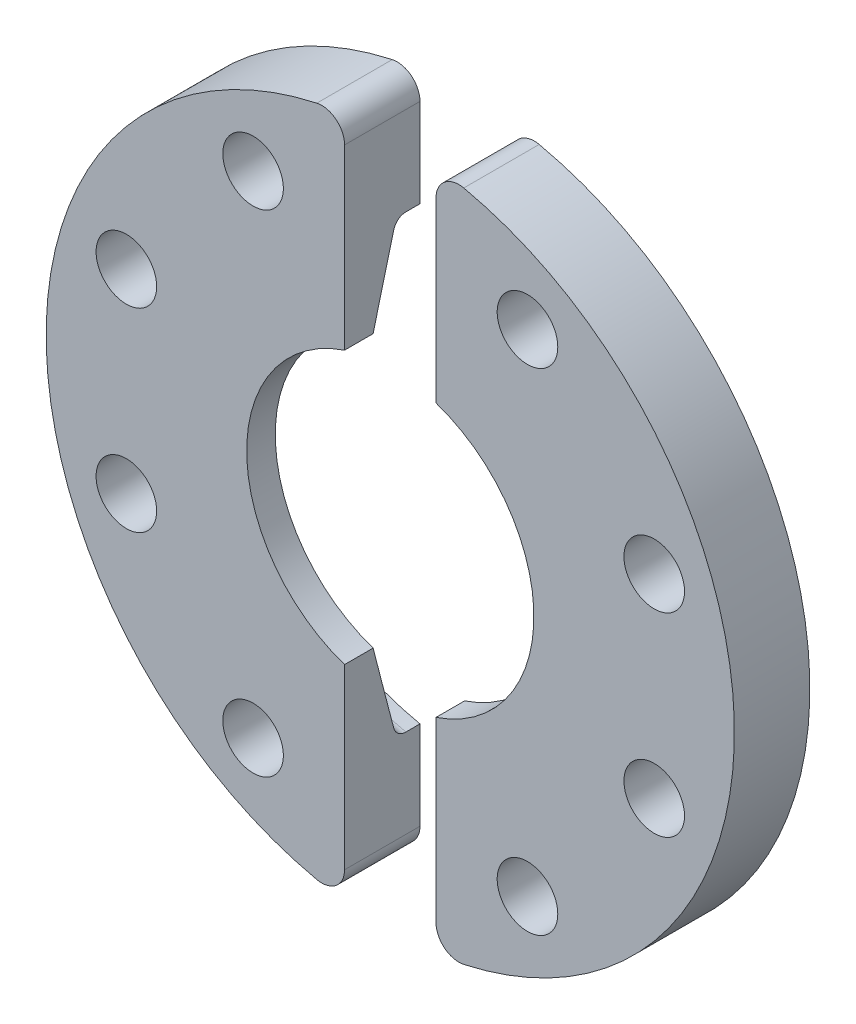
from build123d import *

# Parameters (mm, degrees)
SKETCH3_R          = 2.65
CUT_EXTRUDE1_DEPTH = 10
FILLET1_R          = 2
FILLET2_R          = 2


with BuildPart() as part:
    # Sketch2 → Revolve2 (revolve)
    with BuildSketch(Plane(origin=(0, 18.12022925, 0), x_dir=(1, 0, 0), z_dir=(0, 1, 0)), mode=Mode.PRIVATE) as revolve2_sk:
        with BuildLine():
            Line((29.445318103, -35.886599973), (22.721499058, -37.688241856))
            Line((22.721499058, -37.688241856), (22.721499058, -40.188241856))
            Line((22.721499058, -40.188241856), (40.260617153, -40.188241856))
            Line((40.260617153, -40.188241856), (40.260617153, -33.591649273))
            Line((40.260617153, -33.591649273), (30.260617153, -33.591649273))
            Line((30.260617153, -33.591649273), (30.260617153, -34.824081564))
            ThreePointArc((30.260617153, -34.824081564), (30.033305828, -35.493719136), (29.445318103, -35.886599973))
        make_face()
    revolve(revolve2_sk.sketch.rotate(Axis((10.160617153, 18.12022925, 37.591649273), (0, 0, 1)), 180), axis=Axis((10.160617153, 18.12022925, 37.591649273), (0, 0, 1)))

    # Sketch3 → Cut-Extrude1 (cut)
    with BuildSketch(Plane.XY.offset(40.188241856)):
        with BuildLine():
            ThreePointArc((6.160617153, -11.71280613), (10.160617153, -11.97977075), (14.160617153, -11.71280613))
            Line((14.160617153, -11.71280613), (14.160617153, 6.213266824))
            ThreePointArc((14.160617153, 6.213266824), (10.160617153, 5.559347346), (6.160617153, 6.213266824))
            Line((6.160617153, 6.213266824), (6.160617153, -11.71280613))
        make_face()
        with BuildLine():
            ThreePointArc((6.160617153, 30.027191676), (10.160617153, 30.681111155), (14.160617153, 30.027191676))
            Line((14.160617153, 30.027191676), (14.160617153, 47.95326463))
            ThreePointArc((14.160617153, 47.95326463), (10.160617153, 48.22022925), (6.160617153, 47.95326463))
            Line((6.160617153, 47.95326463), (6.160617153, 30.027191676))
        make_face()
        with Locations((-1.839382847, 39.594865452)):
            Circle(SKETCH3_R)
        with Locations((-12.924226359, 26.62022925)):
            Circle(SKETCH3_R)
        with Locations((-12.924226359, 9.62022925)):
            Circle(SKETCH3_R)
        with Locations((-1.839382847, -3.354406952)):
            Circle(SKETCH3_R)
        with Locations((22.160617153, -3.354406952)):
            Circle(SKETCH3_R)
        with Locations((33.245460666, 9.62022925)):
            Circle(SKETCH3_R)
        with Locations((33.245460666, 26.62022925)):
            Circle(SKETCH3_R)
        with Locations((22.160617153, 39.594865452)):
            Circle(SKETCH3_R)
    extrude(amount=-CUT_EXTRUDE1_DEPTH, mode=Mode.SUBTRACT)


with BuildPart() as cut_extrude1_piece_1:
    # of the separate pieces the step leaves, piece 1, a body of its own (cut_extrude1_pieces)
    add(part.part.solids().sort_by_distance((14.160617153, -1.577740188, 34.824081564))[0])

    # Fillet2
    fillet2_edges = [cut_extrude1_piece_1.edges().sort_by_distance(p)[0] for p in [
        (14.160617153, 47.95326463, 36.889945565),
        (14.160617153, -11.71280613, 36.889945565),
    ]]
    fillet(fillet2_edges, radius=FILLET2_R)


with BuildPart() as cut_extrude1_piece_2:
    # of the separate pieces the step leaves, piece 2, a body of its own (cut_extrude1_pieces)
    add(part.part.solids().sort_by_distance((6.160617153, 36.985533136, 35.886599973))[0])

    # Fillet1
    fillet1_edges = [cut_extrude1_piece_2.edges().sort_by_distance(p)[0] for p in [
        (6.160617153, -11.71280613, 36.889945565),
        (6.160617153, 47.95326463, 36.889945565),
    ]]
    fillet(fillet1_edges, radius=FILLET1_R)


solid = Compound([cut_extrude1_piece_1.part, cut_extrude1_piece_2.part])
